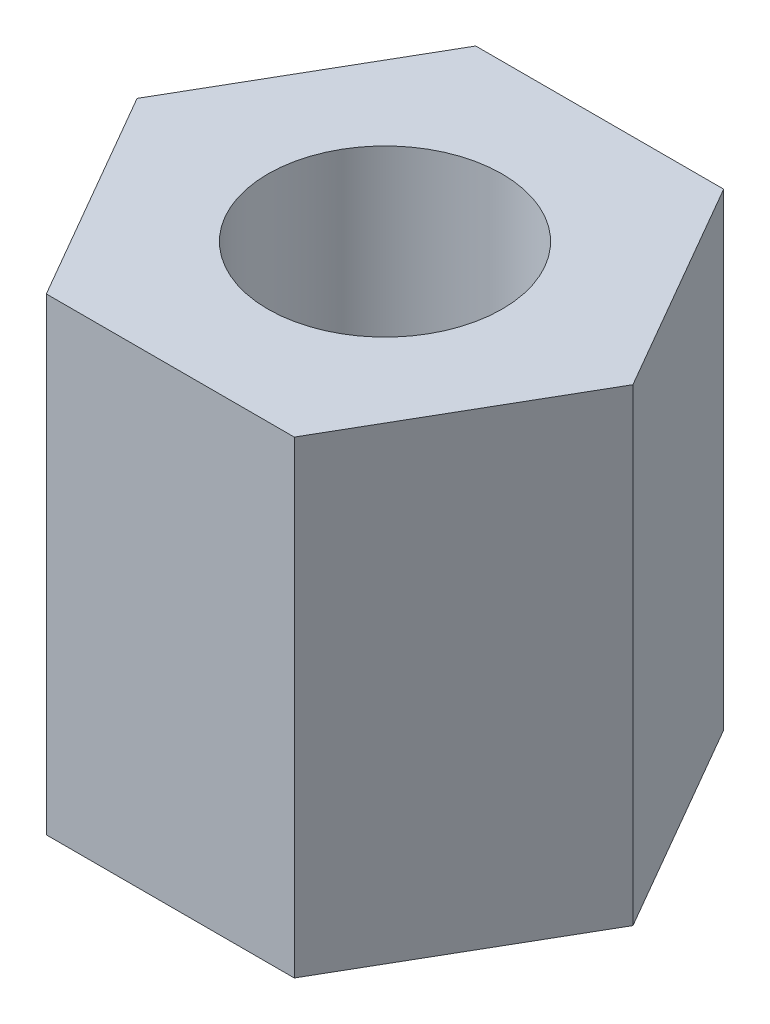
from build123d import *

# Parameters (mm, degrees)
SKETCH_1_R      = 1.5
EXTRUDE_1_DEPTH = 6


with BuildPart() as part:
    # 草图1 → 凸台-拉伸1 (new body)
    with BuildSketch(Plane(origin=(0, 0, 0), x_dir=(1, 0, 0), z_dir=(0, 1, 0))):
        Polygon((-4.147179809, 7.572240595), (-5.734893049, 10.322240595), (-8.91031953, 10.322240595), (-10.49803277, 7.572240595), (-8.91031953, 4.822240595), (-5.734893049, 4.822240595), align=None)
        with Locations(Location((-7.322606289, 7.572240595, 0), (0, 0, 270))):
            Circle(SKETCH_1_R, mode=Mode.SUBTRACT)
    extrude(amount=EXTRUDE_1_DEPTH)


solid = part.part
